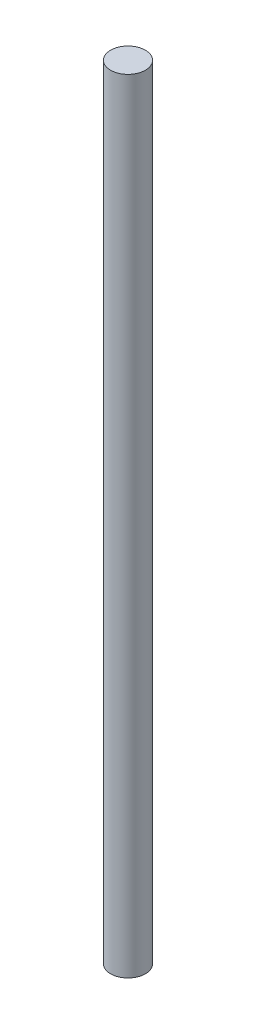
from build123d import *

# Parameters (mm, degrees)
SKETCH_1_R      = 0.1
EXTRUDE_1_DEPTH = 4.5


with BuildPart() as part:
    # Эскиз1 → Бобышка-Вытянуть1 (new body)
    with BuildSketch(Plane(origin=(0, 0, 0), x_dir=(1, 0, 0), z_dir=(0, 1, 0))):
        with Locations(Location((0, 0, 0), (0, 0, 270))):
            Circle(SKETCH_1_R)
    extrude(amount=EXTRUDE_1_DEPTH)


solid = part.part
